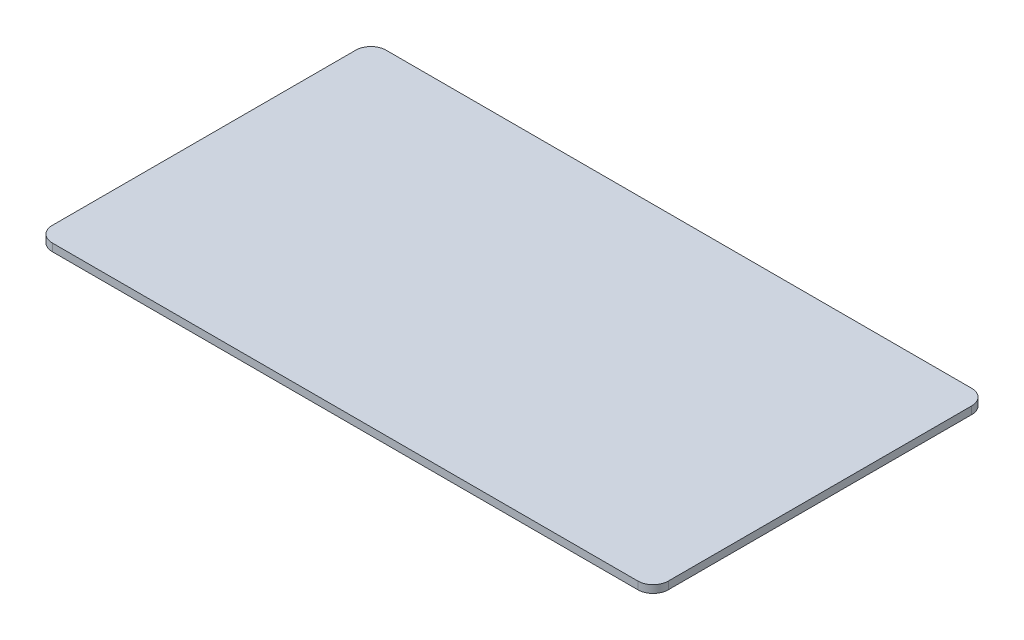
from build123d import *

# Parameters (mm, degrees)
ESQUISSE1_W        = 121.6
ESQUISSE1_H        = 65.9
BOSS_EXTRU_1_DEPTH = 1.5
CONG_1_R           = 3


with BuildPart() as part:
    # Esquisse1 → Boss.-Extru.1 (new body)
    with BuildSketch(Plane(origin=(0, 0, 0), x_dir=(1, 0, 0), z_dir=(0, 1, 0))):
        Rectangle(ESQUISSE1_W, ESQUISSE1_H)
    extrude(amount=BOSS_EXTRU_1_DEPTH)

    # Congé1
    cong_1_edges = [part.edges().sort_by_distance(p)[0] for p in [
        (60.8, 0.75, 32.95),
        (-60.8, 0.75, 32.95),
        (-60.8, 0.75, -32.95),
        (60.8, 0.75, -32.95),
    ]]
    fillet(cong_1_edges, radius=CONG_1_R)


solid = part.part
